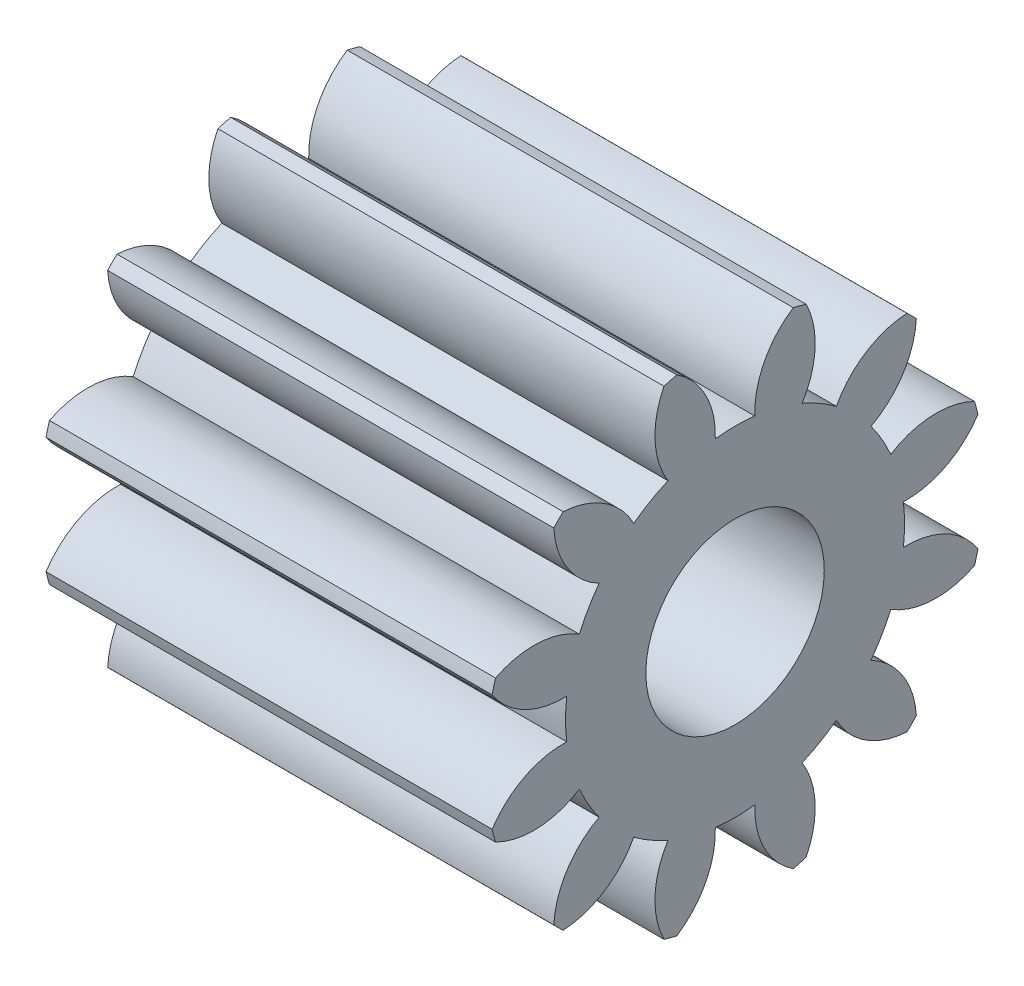
from build123d import *

# Parameters (mm, degrees)
BASPROSKE_W     = 100
BASPROSKE_H     = 56
TOOTHCUT_DEPTH  = 128.561749753
TEETHCUTS_COUNT = 12
TEETHCUTS_ANGLE = 330
BORSKE_R        = 20
BORE_DEPTH      = 100.0000508


with BuildPart() as part:
    # BasProSke → Base-Revolve (revolve)
    with BuildSketch(Plane(origin=(0, 0, 0), x_dir=(1, 0, 0), z_dir=(0, 1, 0)), mode=Mode.PRIVATE) as base_revolve_sk:
        with Locations((50, 28)):
            Rectangle(BASPROSKE_W, BASPROSKE_H)
    revolve(base_revolve_sk.sketch.rotate(Axis((-10, 0, 0), (1, 0, 0)), 180), axis=Axis((-10, 0, 0), (1, 0, 0)))

    # TooCutSke → ToothCut (cut, through all)
    with BuildSketch(Plane(origin=(0, 0, 0), x_dir=(0, 0, -1), z_dir=(1, 0, 0))):
        with BuildLine():
            ThreePointArc((4.429508858, 37.739945049), (0, 37.999), (-4.429508858, 37.739945049))
            ThreePointArc((-4.429508858, 37.739945049), (-6.560078122, 47.242513828), (-13.078840191, 54.477420868))
            ThreePointArc((-13.078840191, 54.477420868), (0, 56.0254), (13.078840191, 54.477420868))
            ThreePointArc((13.078840191, 54.477420868), (6.560078122, 47.242513828), (4.429508858, 37.739945049))
        make_face()
    toothcut = extrude(amount=TOOTHCUT_DEPTH, mode=Mode.SUBTRACT)

    # TeethCuts: ToothCut ×12 about axis
    teethcuts_axis = Axis((-10, 0, 0), (1, 0, 0))
    for i in range(1, TEETHCUTS_COUNT):
        add(toothcut.rotate(teethcuts_axis, i * TEETHCUTS_ANGLE / (TEETHCUTS_COUNT - 1)), mode=Mode.SUBTRACT)

    # BorSke → Bore (cut, symmetric)
    with BuildSketch(Plane(origin=(0, 0, 0), x_dir=(0, 0, -1), z_dir=(1, 0, 0))):
        with Locations(Location((0, 0, 0), (0, 0, 180))):
            Circle(BORSKE_R)
    extrude(amount=BORE_DEPTH, both=True, mode=Mode.SUBTRACT)


solid = part.part
